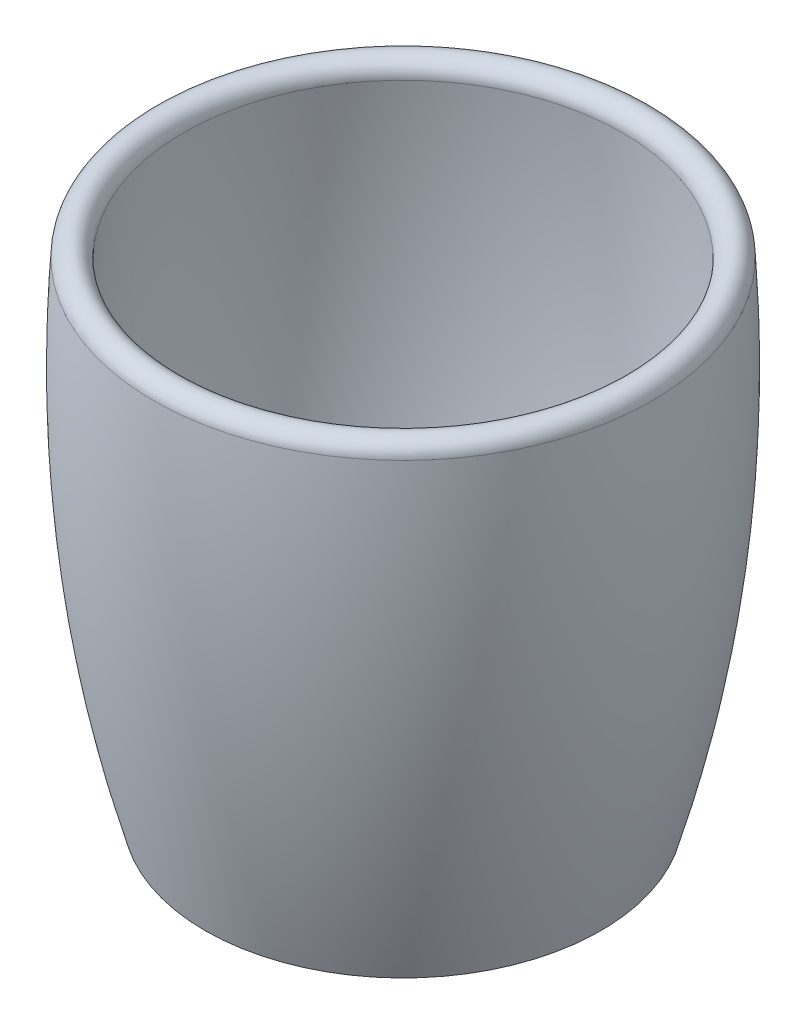
from build123d import *


with BuildPart() as part:
    # Sketch1 → Revolve1 (revolve)
    with BuildSketch(Plane.XY, mode=Mode.PRIVATE) as revolve1_sk:
        with BuildLine():
            Line((0, 0), (33.25, 0))
            add(Edge.make_bspline(
                [(33.25, 0), (40.770585082, 26.227397042), (43.637251749, 53.360730375), (41.85, 81.4)],
                knots=[0, 0, 0, 0, 1, 1, 1, 1], degree=3))
            ThreePointArc((41.85, 81.4), (39.1960334, 83.735906952), (36.860126448, 81.081940352))
            add(Edge.make_bspline(
                [(29.450423152, 5), (31.098721331, 11.122731195), (33.890065025, 23.513467046), (36.51627774, 42.362705396), (37.414431967, 58.346354897), (37.357321389, 71.274458443), (37.067836742, 77.823280829), (36.860126448, 81.081940352)],
                knots=[0.046951369, 0.046951369, 0.046951369, 0.046951369, 0.285213527, 0.523475685, 0.761737842, 0.880868921, 1, 1, 1, 1], degree=3))
            Line((29.450423152, 5), (0, 5))
            Line((0, 5), (0, 0))
        make_face()
    revolve(revolve1_sk.sketch.rotate(Axis((0, 0, 0), (0, 1, 0)), 90), axis=Axis((0, 0, 0), (0, 1, 0)))


solid = part.part
